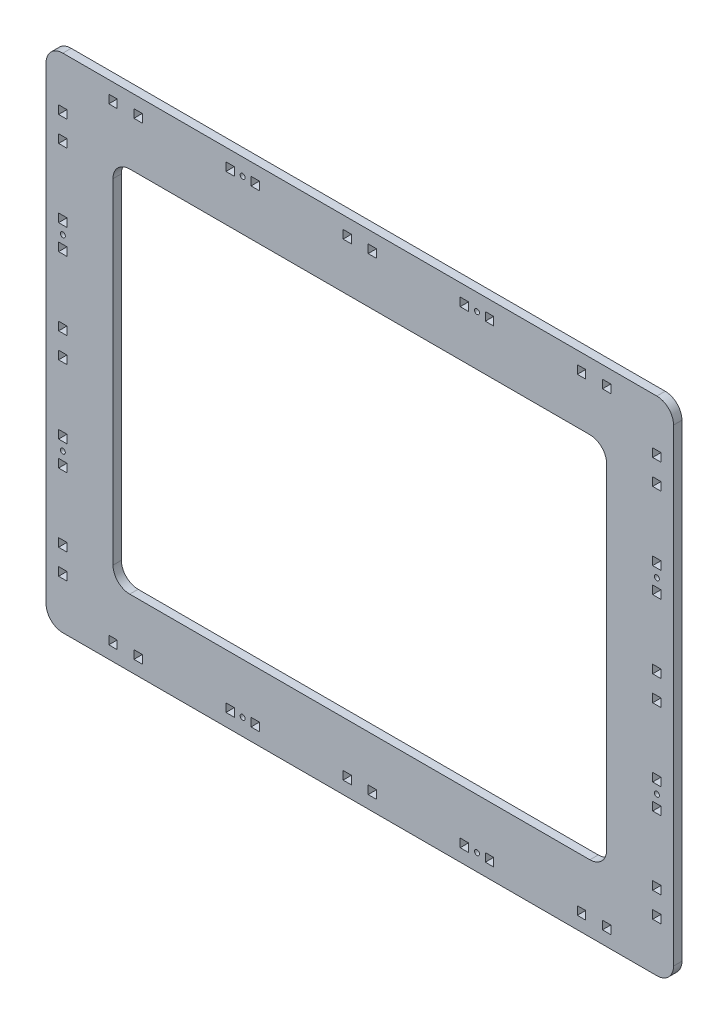
from build123d import *

# Parameters (mm, degrees)
SKETCH1_W           = 375
SKETCH1_H           = 300
SKETCH1_R           = 1.5
SKETCH1_W_2         = 5
SKETCH1_H_2         = 5
BOSS_EXTRUDE2_DEPTH = 5
FILLET1_R           = 10


with BuildPart() as part:
    # Sketch1 → Boss-Extrude2 (new body)
    with BuildSketch(Plane.XY):
        Rectangle(SKETCH1_W, SKETCH1_H)
        with Locations((-177.5, 56)):
            Circle(SKETCH1_R, mode=Mode.SUBTRACT)
        with Locations(Location((177.5, 56, 0), (0, 0, 180))):
            Circle(SKETCH1_R, mode=Mode.SUBTRACT)
        with Locations((-70, 140)):
            Circle(SKETCH1_R, mode=Mode.SUBTRACT)
        with Locations((70, 140)):
            Circle(SKETCH1_R, mode=Mode.SUBTRACT)
        with Locations(Location((70, -140, 0), (0, 0, 180))):
            Circle(SKETCH1_R, mode=Mode.SUBTRACT)
        with Locations(Location((-70, -140, 0), (0, 0, 180))):
            Circle(SKETCH1_R, mode=Mode.SUBTRACT)
        with Locations((177.5, -56)):
            Circle(SKETCH1_R, mode=Mode.SUBTRACT)
        with Locations((-177.5, -56)):
            Circle(SKETCH1_R, mode=Mode.SUBTRACT)
        with Locations((-177.5, -7.5)):
            Rectangle(SKETCH1_W_2, SKETCH1_H_2, mode=Mode.SUBTRACT)
        with Locations((-177.5, 7.5)):
            Rectangle(SKETCH1_W_2, SKETCH1_H_2, mode=Mode.SUBTRACT)
        with Locations((177.5, -63.5)):
            Rectangle(SKETCH1_W_2, SKETCH1_H_2, mode=Mode.SUBTRACT)
        with Locations((-177.5, 104.5)):
            Rectangle(SKETCH1_W_2, SKETCH1_H_2, mode=Mode.SUBTRACT)
        with Locations((-177.5, 119.5)):
            Rectangle(SKETCH1_W_2, SKETCH1_H_2, mode=Mode.SUBTRACT)
        with Locations((-177.5, 48.5)):
            Rectangle(SKETCH1_W_2, SKETCH1_H_2, mode=Mode.SUBTRACT)
        with Locations((-177.5, 63.5)):
            Rectangle(SKETCH1_W_2, SKETCH1_H_2, mode=Mode.SUBTRACT)
        with Locations((177.5, -48.5)):
            Rectangle(SKETCH1_W_2, SKETCH1_H_2, mode=Mode.SUBTRACT)
        with Locations((177.5, 63.5)):
            Rectangle(SKETCH1_W_2, SKETCH1_H_2, mode=Mode.SUBTRACT)
        with Locations((177.5, 48.5)):
            Rectangle(SKETCH1_W_2, SKETCH1_H_2, mode=Mode.SUBTRACT)
        with Locations((177.5, 119.5)):
            Rectangle(SKETCH1_W_2, SKETCH1_H_2, mode=Mode.SUBTRACT)
        with Locations((177.5, 104.5)):
            Rectangle(SKETCH1_W_2, SKETCH1_H_2, mode=Mode.SUBTRACT)
        with Locations((177.5, 7.5)):
            Rectangle(SKETCH1_W_2, SKETCH1_H_2, mode=Mode.SUBTRACT)
        with Locations((177.5, -7.5)):
            Rectangle(SKETCH1_W_2, SKETCH1_H_2, mode=Mode.SUBTRACT)
        with Locations((-147.5, 140)):
            Rectangle(SKETCH1_W_2, SKETCH1_H_2, mode=Mode.SUBTRACT)
        with Locations((-132.5, 140)):
            Rectangle(SKETCH1_W_2, SKETCH1_H_2, mode=Mode.SUBTRACT)
        with Locations((-77.5, 140)):
            Rectangle(SKETCH1_W_2, SKETCH1_H_2, mode=Mode.SUBTRACT)
        with Locations((-62.5, 140)):
            Rectangle(SKETCH1_W_2, SKETCH1_H_2, mode=Mode.SUBTRACT)
        with Locations((-7.5, 140)):
            Rectangle(SKETCH1_W_2, SKETCH1_H_2, mode=Mode.SUBTRACT)
        with Locations((7.5, 140)):
            Rectangle(SKETCH1_W_2, SKETCH1_H_2, mode=Mode.SUBTRACT)
        with Locations((62.5, 140)):
            Rectangle(SKETCH1_W_2, SKETCH1_H_2, mode=Mode.SUBTRACT)
        with Locations((77.5, 140)):
            Rectangle(SKETCH1_W_2, SKETCH1_H_2, mode=Mode.SUBTRACT)
        with Locations((132.5, 140)):
            Rectangle(SKETCH1_W_2, SKETCH1_H_2, mode=Mode.SUBTRACT)
        with Locations((147.5, 140)):
            Rectangle(SKETCH1_W_2, SKETCH1_H_2, mode=Mode.SUBTRACT)
        with Locations((147.5, -140)):
            Rectangle(SKETCH1_W_2, SKETCH1_H_2, mode=Mode.SUBTRACT)
        with Locations((132.5, -140)):
            Rectangle(SKETCH1_W_2, SKETCH1_H_2, mode=Mode.SUBTRACT)
        with Locations((77.5, -140)):
            Rectangle(SKETCH1_W_2, SKETCH1_H_2, mode=Mode.SUBTRACT)
        with Locations((62.5, -140)):
            Rectangle(SKETCH1_W_2, SKETCH1_H_2, mode=Mode.SUBTRACT)
        with Locations((7.5, -140)):
            Rectangle(SKETCH1_W_2, SKETCH1_H_2, mode=Mode.SUBTRACT)
        with Locations((-7.5, -140)):
            Rectangle(SKETCH1_W_2, SKETCH1_H_2, mode=Mode.SUBTRACT)
        with Locations((-62.5, -140)):
            Rectangle(SKETCH1_W_2, SKETCH1_H_2, mode=Mode.SUBTRACT)
        with Locations((-77.5, -140)):
            Rectangle(SKETCH1_W_2, SKETCH1_H_2, mode=Mode.SUBTRACT)
        with Locations((-132.5, -140)):
            Rectangle(SKETCH1_W_2, SKETCH1_H_2, mode=Mode.SUBTRACT)
        with Locations((-147.5, -140)):
            Rectangle(SKETCH1_W_2, SKETCH1_H_2, mode=Mode.SUBTRACT)
        with BuildLine():
            Line((-137.5, -110), (137.5, -110))
            ThreePointArc((137.5, -110), (144.571067812, -107.071067812), (147.5, -100))
            Line((147.5, -100), (147.5, 100))
            ThreePointArc((147.5, 100), (144.571067812, 107.071067812), (137.5, 110))
            Line((137.5, 110), (-137.5, 110))
            ThreePointArc((-137.5, 110), (-144.571067812, 107.071067812), (-147.5, 100))
            Line((-147.5, 100), (-147.5, -100))
            ThreePointArc((-147.5, -100), (-144.571067812, -107.071067812), (-137.5, -110))
        make_face(mode=Mode.SUBTRACT)
        with Locations((177.5, -119.5)):
            Rectangle(SKETCH1_W_2, SKETCH1_H_2, mode=Mode.SUBTRACT)
        with Locations((177.5, -104.5)):
            Rectangle(SKETCH1_W_2, SKETCH1_H_2, mode=Mode.SUBTRACT)
        with Locations((-177.5, -119.5)):
            Rectangle(SKETCH1_W_2, SKETCH1_H_2, mode=Mode.SUBTRACT)
        with Locations((-177.5, -104.5)):
            Rectangle(SKETCH1_W_2, SKETCH1_H_2, mode=Mode.SUBTRACT)
        with Locations((-177.5, -63.5)):
            Rectangle(SKETCH1_W_2, SKETCH1_H_2, mode=Mode.SUBTRACT)
        with Locations((-177.5, -48.5)):
            Rectangle(SKETCH1_W_2, SKETCH1_H_2, mode=Mode.SUBTRACT)
    extrude(amount=BOSS_EXTRUDE2_DEPTH)

    # Fillet1
    fillet1_edges = [part.edges().sort_by_distance(p)[0] for p in [
        (187.5, -150, 2.5),
        (-187.5, -150, 2.5),
        (-187.5, 150, 2.5),
        (187.5, 150, 2.5),
    ]]
    fillet(fillet1_edges, radius=FILLET1_R)


solid = part.part
